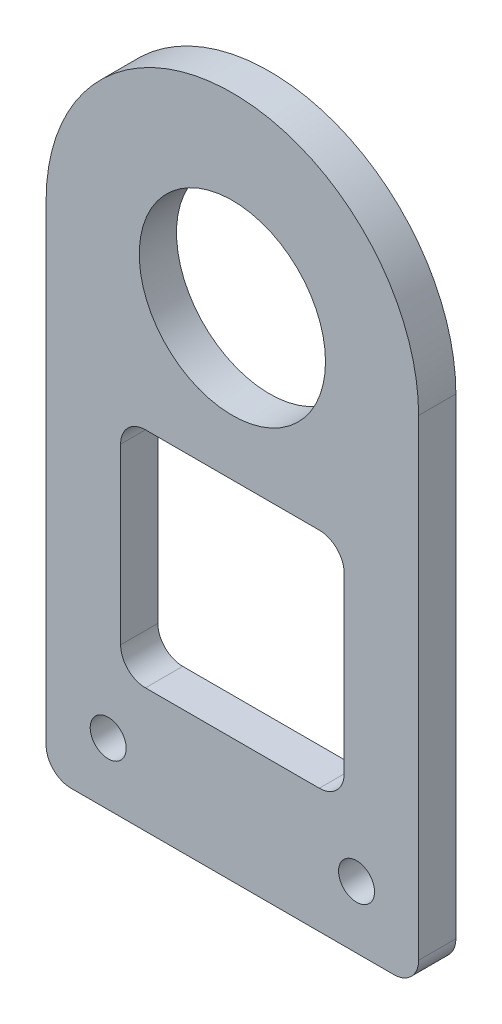
from build123d import *

# Parameters (mm, degrees)
SKETCH_1_R      = 7.5
SKETCH_1_R_2    = 1.45
SKETCH_1_W      = 18
SKETCH_1_H      = 18
EXTRUDE_1_DEPTH = 3
FILLET_1_R      = 2


with BuildPart() as part:
    # 草图1 → 凸台-拉伸1 (new body)
    with BuildSketch(Plane.XY):
        with BuildLine():
            Line((-15, 35), (-15, -5))
            Line((-15, -5), (15, -5))
            Line((15, -5), (15, 35))
            ThreePointArc((15, 35), (0, 50), (-15, 35))
        make_face()
        with Locations((0, 35)):
            Circle(SKETCH_1_R, mode=Mode.SUBTRACT)
        with Locations((-10, 0)):
            Circle(SKETCH_1_R_2, mode=Mode.SUBTRACT)
        with Locations((10, 0)):
            Circle(SKETCH_1_R_2, mode=Mode.SUBTRACT)
        with Locations((0, 14)):
            Rectangle(SKETCH_1_W, SKETCH_1_H, mode=Mode.SUBTRACT)
    extrude(amount=EXTRUDE_1_DEPTH)

    # 圆角1
    fillet_1_edges = [part.edges().sort_by_distance(p)[0] for p in [
        (9, 5, 1.5),
        (9, 23, 1.5),
        (-9, 23, 1.5),
        (-9, 5, 1.5),
        (15, -5, 1.5),
        (-15, -5, 1.5),
    ]]
    fillet(fillet_1_edges, radius=FILLET_1_R)


solid = part.part
